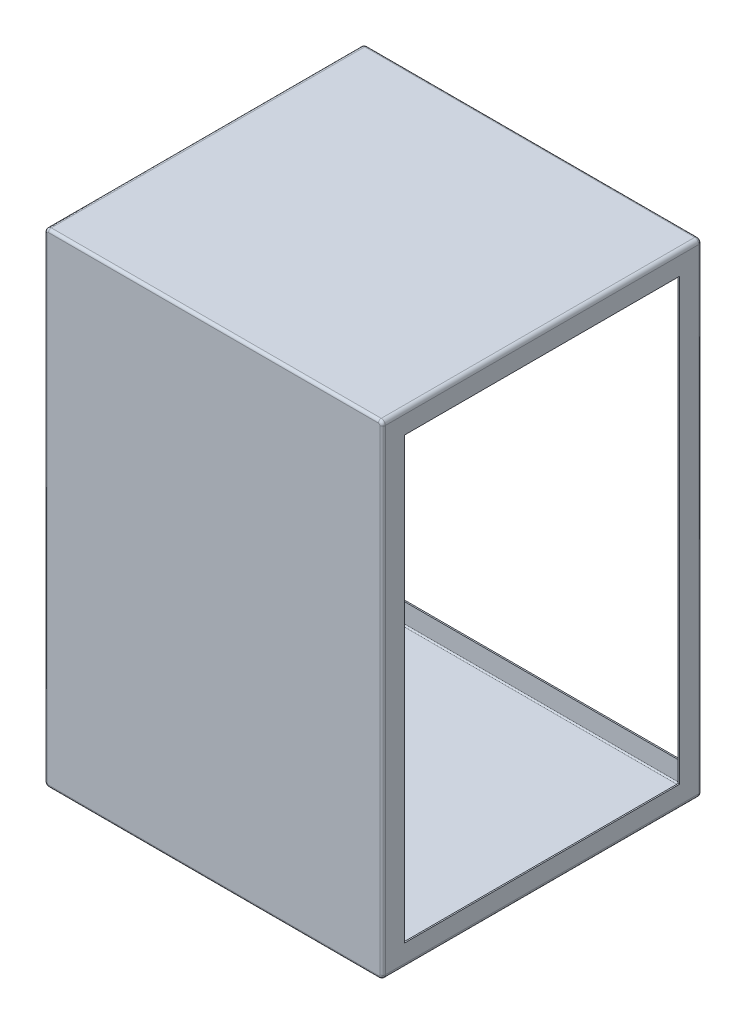
from build123d import *

# Parameters (mm, degrees)
EXTRUDE_1_DEPTH     = 232
SKETCH_2_W          = 200
SKETCH_2_H          = 320
CUT_EXTRUDE_1_DEPTH = 500
EXTRUDE_START       = -1
EXTRUDE_1_2_DEPTH   = 1
SKETCH_4_W          = 214
SKETCH_4_H          = 320
EXTRUDE_2_DEPTH     = 1
FILLET_1_R          = 1
FILLET_2_R          = 2


with BuildPart() as part:
    # Эскиз1 → Extrude 1 (new body)
    with BuildSketch(Plane.XY):
        with BuildLine():
            Line((123, -173), (123, 173))
            ThreePointArc((123, 173), (122.121320344, 175.121320344), (120, 176))
            Line((120, 176), (-120, 176))
            ThreePointArc((-120, 176), (-122.121320344, 175.121320344), (-123, 173))
            Line((-123, 173), (-123, -173))
            ThreePointArc((-123, -173), (-122.121320344, -175.121320344), (-120, -176))
            Line((-120, -176), (120, -176))
            ThreePointArc((120, -176), (122.121320344, -175.121320344), (123, -173))
        make_face()
        with BuildLine():
            Line((122, -173), (122, 173))
            ThreePointArc((122, 173), (121.414213562, 174.414213562), (120, 175))
            Line((120, 175), (-120, 175))
            ThreePointArc((-120, 175), (-121.414213562, 174.414213562), (-122, 173))
            Line((-122, 173), (-122, -173))
            ThreePointArc((-122, -173), (-121.414213562, -174.414213562), (-120, -175))
            Line((-120, -175), (120, -175))
            ThreePointArc((120, -175), (121.414213562, -174.414213562), (122, -173))
        make_face(mode=Mode.SUBTRACT)
    extrude(amount=EXTRUDE_1_DEPTH)

    # Эскиз2 → Вырез-Вытянуть1 (cut)
    with BuildSketch(Plane(origin=(123, 0, 0), x_dir=(0, 0, -1), z_dir=(1, 0, 0))):
        with Locations((-116, 0)):
            Rectangle(SKETCH_2_W, SKETCH_2_H)
    extrude(amount=-CUT_EXTRUDE_1_DEPTH, mode=Mode.SUBTRACT)

    # Эскиз3 → Extrude 1 2 (add)
    with BuildSketch(Plane.XY.offset(232).offset(EXTRUDE_START)):
        with BuildLine():
            Line((-123, 173), (-123, -173))
            ThreePointArc((-123, -173), (-122.121320344, -175.121320344), (-120, -176))
            Line((-120, -176), (120, -176))
            ThreePointArc((120, -176), (122.121320344, -175.121320344), (123, -173))
            Line((123, -173), (123, 173))
            ThreePointArc((123, 173), (122.121320344, 175.121320344), (120, 176))
            Line((120, 176), (-120, 176))
            ThreePointArc((-120, 176), (-122.121320344, 175.121320344), (-123, 173))
        make_face()
    extrude(amount=EXTRUDE_1_2_DEPTH)

    # Эскиз4 → Вытянуть2 (add)
    with BuildSketch(Plane(origin=(0, 0, 0), x_dir=(-1, 0, 0), z_dir=(0, 0, -1))):
        with BuildLine():
            Line((120, 176), (-120, 176))
            ThreePointArc((-120, 176), (-122.121320344, 175.121320344), (-123, 173))
            Line((-123, 173), (-123, -173))
            ThreePointArc((-123, -173), (-122.121320344, -175.121320344), (-120, -176))
            Line((-120, -176), (120, -176))
            ThreePointArc((120, -176), (122.121320344, -175.121320344), (123, -173))
            Line((123, -173), (123, 173))
            ThreePointArc((123, 173), (122.121320344, 175.121320344), (120, 176))
        make_face()
        Rectangle(SKETCH_4_W, SKETCH_4_H, mode=Mode.SUBTRACT)
    extrude(amount=-EXTRUDE_2_DEPTH)

    # Скругление1
    fillet_1_edges = [part.edges().sort_by_distance(p)[0] for p in [
        (-122, 0, 1),
        (-121.414213562, 174.414213562, 1),
        (0, 175, 1),
        (121.414213562, 174.414213562, 1),
        (122, 0, 1),
        (121.414213562, -174.414213562, 1),
        (0, -175, 1),
        (-121.414213562, -174.414213562, 1),
        (0, 175, 231),
        (-121.414213562, 174.414213562, 231),
        (-122, 0, 231),
        (-121.414213562, -174.414213562, 231),
        (0, -175, 231),
        (121.414213562, -174.414213562, 231),
        (122, 0, 231),
        (121.414213562, 174.414213562, 231),
    ]]
    fillet(fillet_1_edges, radius=FILLET_1_R)

    # Скругление2
    fillet_2_edges = [part.edges().sort_by_distance(p)[0] for p in [
        (-122.121320344, -175.121320344, 232),
        (0, -176, 232),
        (122.121320344, -175.121320344, 232),
        (123, 0, 232),
        (122.121320344, 175.121320344, 232),
        (0, 176, 232),
        (-122.121320344, 175.121320344, 232),
        (0, 176, 0),
        (122.121320344, 175.121320344, 0),
        (123, 0, 0),
        (122.121320344, -175.121320344, 0),
        (0, -176, 0),
        (-122.121320344, -175.121320344, 0),
        (-123, 0, 0),
        (-122.121320344, 175.121320344, 0),
        (-123, 0, 232),
    ]]
    fillet(fillet_2_edges, radius=FILLET_2_R)


solid = part.part
